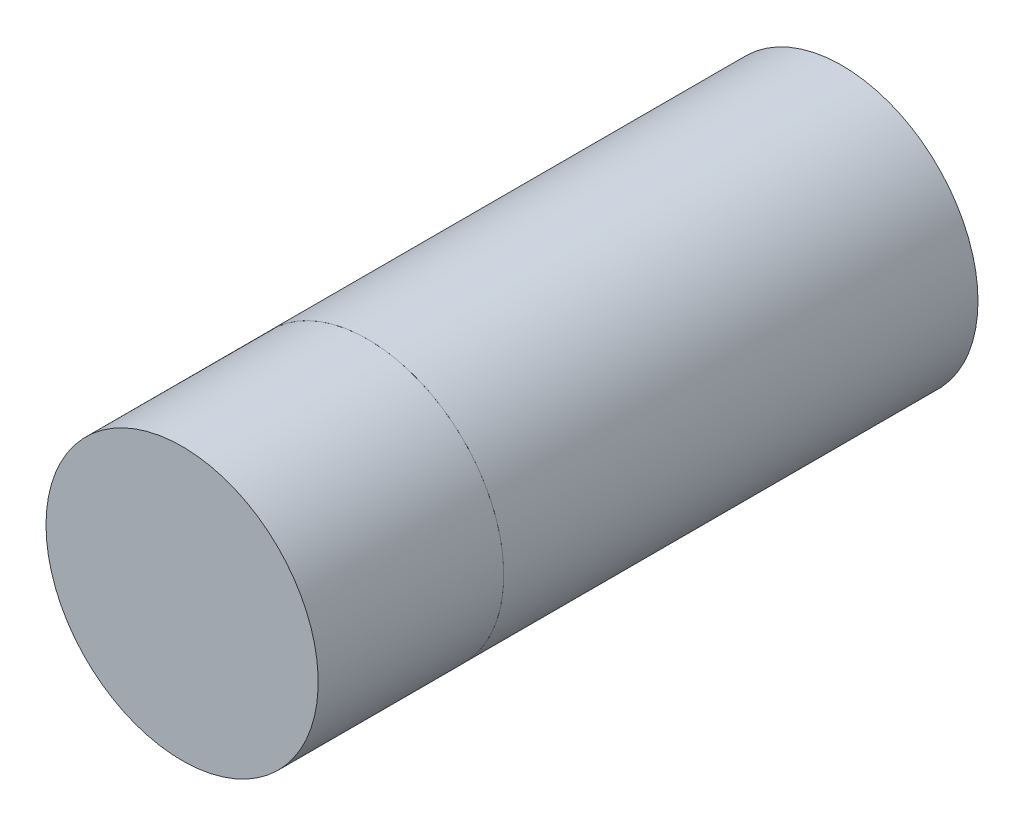
from build123d import *

# Parameters (mm, degrees)
SKETCH1_R                             = 33
CANSAT_COMPONENTS_ENVELOPE_DEPTH      = 115
SKETCH2_R                             = 33
PARACHUTE_AND_ANTENNAS_ENVELOPE_DEPTH = 45


with BuildPart() as part:
    # Sketch1 → Cansat components envelope (new body)
    with BuildSketch(Plane.XY):
        Circle(SKETCH1_R)
    extrude(amount=CANSAT_COMPONENTS_ENVELOPE_DEPTH)


with BuildPart() as body_2:
    # Sketch2 → Parachute and antennas envelope (new body)
    with BuildSketch(Plane.XY.offset(115)):
        with Locations(Location((0, 0, 0), (0, 0, 180))):
            Circle(SKETCH2_R)
    extrude(amount=PARACHUTE_AND_ANTENNAS_ENVELOPE_DEPTH)


solid = Compound([part.part, body_2.part])
